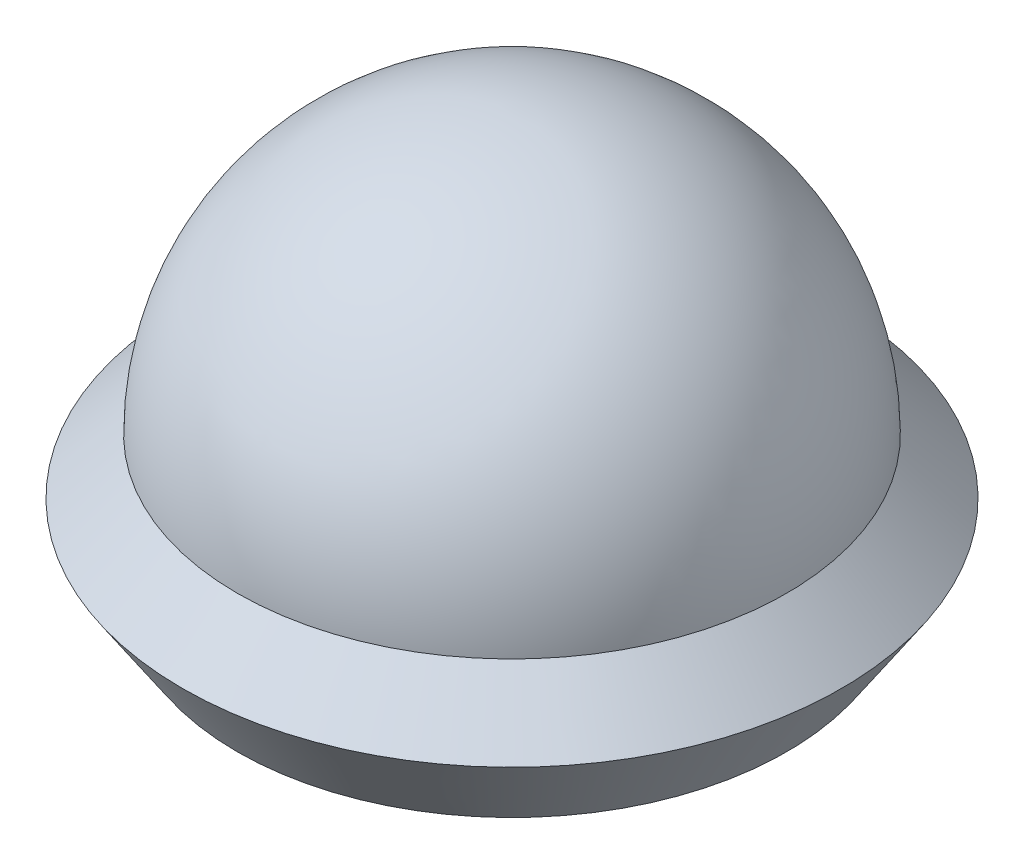
from build123d import *

# Parameters (mm, degrees)
R_VOLUTION2_ANGLE       = 180
ESQUISSE3_W             = 10.5
ESQUISSE3_H             = 4.5
ENL_V_MAT_EXTRU_1_DEPTH = 15


with BuildPart() as part:
    # Esquisse1 → Révolution1 (revolve)
    with BuildSketch(Plane.XY, mode=Mode.PRIVATE) as r_volution1_sk:
        Polygon((0, 0), (20, 0), (24, 6), (20, 10), (0, 10), align=None)
    revolve(r_volution1_sk.sketch.rotate(Axis((0, 0, 0), (0, 1, 0)), 90), axis=Axis((0, 0, 0), (0, 1, 0)))

    # Esquisse2 → Révolution2 (revolve)
    with BuildSketch(Plane(origin=(0, 10, 0), x_dir=(1, 0, 0), z_dir=(0, 1, 0))):
        with BuildLine():
            Line((-20, 0), (20, 0))
            ThreePointArc((20, 0), (0, 20), (-20, 0))
        make_face()
    revolve(axis=Axis((-20, 10, 0), (1, 0, 0)), revolution_arc=R_VOLUTION2_ANGLE)

    # Esquisse3 → Enlèv. mat.-Extru.1 (cut)
    with BuildSketch(Plane.XZ):
        Rectangle(ESQUISSE3_W, ESQUISSE3_H)
    extrude(amount=-ENL_V_MAT_EXTRU_1_DEPTH, mode=Mode.SUBTRACT)


solid = part.part
